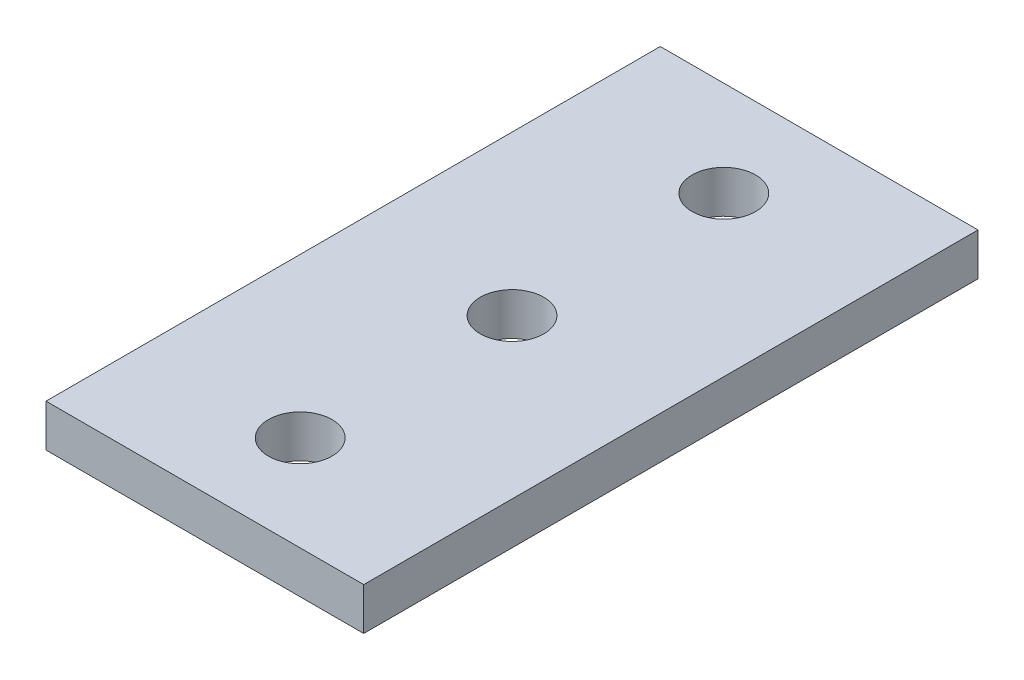
from build123d import *

# Parameters (mm, degrees)
SKETCH1_W           = 15
SKETCH1_H           = 29
SKETCH1_R           = 1.5
BOSS_EXTRUDE1_DEPTH = 2


with BuildPart() as part:
    # Sketch1 → Boss-Extrude1 (new body)
    with BuildSketch(Plane(origin=(0, 0, 0), x_dir=(1, 0, 0), z_dir=(0, 1, 0))):
        with Locations((7.5, 14.5)):
            Rectangle(SKETCH1_W, SKETCH1_H)
        with Locations(Location((7.5, 24.5, 0), (0, 0, 270))):
            Circle(SKETCH1_R, mode=Mode.SUBTRACT)
        with Locations(Location((7.5, 14.5, 0), (0, 0, 270))):
            Circle(SKETCH1_R, mode=Mode.SUBTRACT)
        with Locations(Location((7.5, 4.5, 0), (0, 0, 270))):
            Circle(SKETCH1_R, mode=Mode.SUBTRACT)
    extrude(amount=BOSS_EXTRUDE1_DEPTH)


solid = part.part
